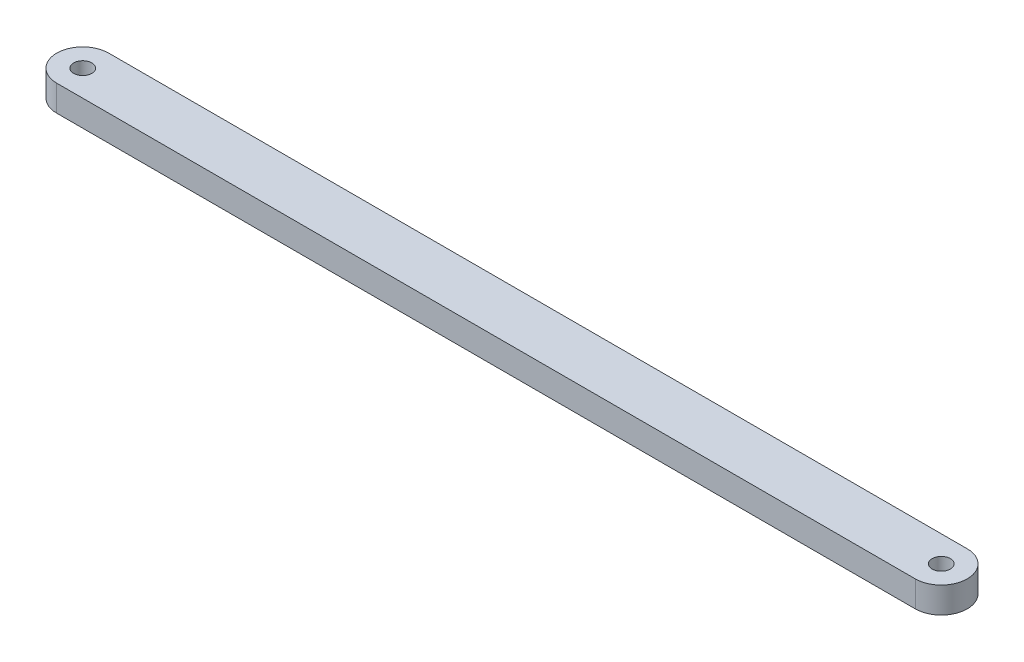
from build123d import *

# Parameters (mm, degrees)
SKETCH1_R           = 3.5
BOSS_EXTRUDE1_DEPTH = 10


with BuildPart() as part:
    # Sketch1 → Boss-Extrude1 (new body)
    with BuildSketch(Plane(origin=(0, 0, 0), x_dir=(1, 0, 0), z_dir=(0, 1, 0))):
        with BuildLine():
            Line((-165, 10), (165, 10))
            ThreePointArc((165, 10), (175, 0), (165, -10))
            Line((165, -10), (-165, -10))
            ThreePointArc((-165, -10), (-175, 0), (-165, 10))
        make_face()
        with Locations(Location((-165, 0, 0), (0, 0, 270))):
            Circle(SKETCH1_R, mode=Mode.SUBTRACT)
        with Locations(Location((165, 0, 0), (0, 0, 270))):
            Circle(SKETCH1_R, mode=Mode.SUBTRACT)
    extrude(amount=BOSS_EXTRUDE1_DEPTH)


solid = part.part
